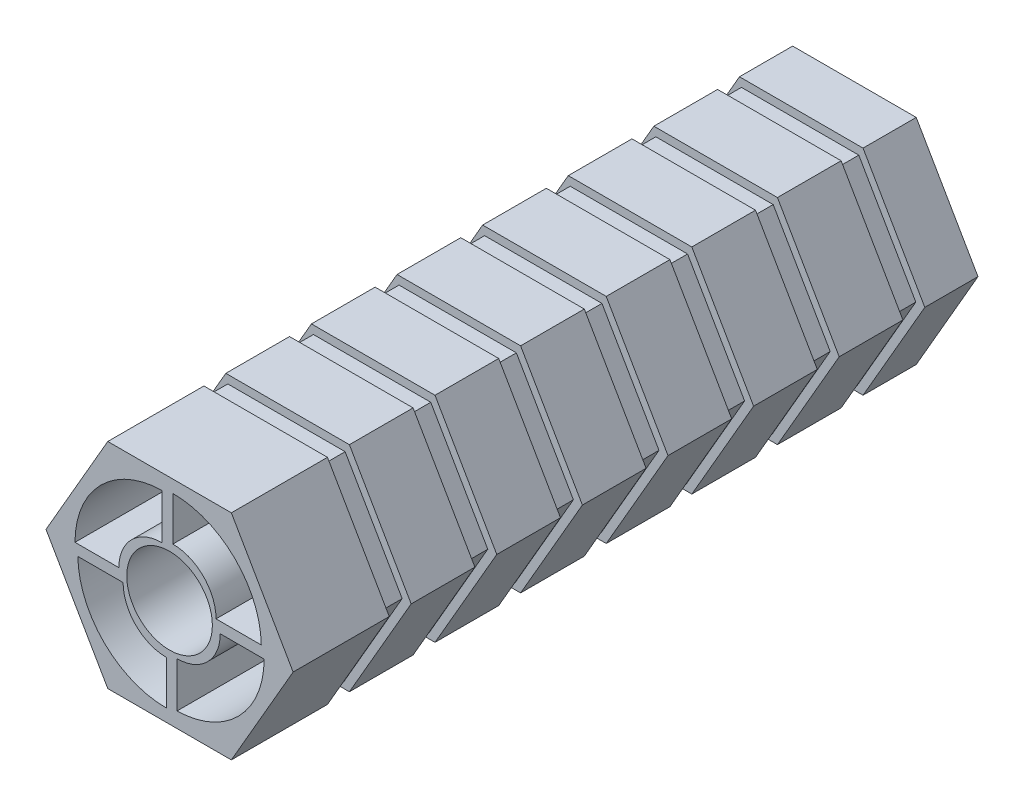
from build123d import *

# Parameters (mm, degrees)
SKETCH1_R           = 5
BOSS_EXTRUDE1_DEPTH = 40
CUT_EXTRUDE1_DEPTH  = 45.32362049
SKETCH6_R           = 5
BOSS_EXTRUDE2_DEPTH = 40
SKETCH7_W           = 2.986363981
SKETCH7_H           = 2.559740555
CUT_EXTRUDE2_DEPTH  = 24
SKETCH9_W           = 2.559740555
SKETCH9_H           = 1.640813603
CUT_EXTRUDE3_DEPTH  = 24
SKETCH10_W          = 3.157013352
SKETCH10_H          = 2.559740555
CUT_EXTRUDE4_DEPTH  = 24
CUT_EXTRUDE5_DEPTH  = 24
SKETCH15_W          = 2.180490195
SKETCH15_H          = 2.559740555
CUT_EXTRUDE6_DEPTH  = 24
SKETCH16_W          = 2.559740555
SKETCH16_H          = 2.986363981
CUT_EXTRUDE7_DEPTH  = 24
SKETCH17_W          = 2.559740555
SKETCH17_H          = 2.753569082
CUT_EXTRUDE8_DEPTH  = 24


with BuildPart() as part:
    # Sketch1 → Boss-Extrude1 (new body)
    with BuildSketch(Plane.XY):
        Polygon((-14.43375673, 0), (-7.216878365, -12.5), (7.216878365, -12.5), (14.43375673, 0), (7.216878365, 12.5), (-7.216878365, 12.5), align=None)
        Circle(SKETCH1_R, mode=Mode.SUBTRACT)
    extrude(amount=BOSS_EXTRUDE1_DEPTH)

    # Sketch2 → Cut-Extrude1 (cut, through all)
    with BuildSketch(Plane.XY.offset(40)):
        with BuildLine():
            Line((-0.876158373, 10.714407614), (-0.876158373, 5.428874285))
            ThreePointArc((-0.876158373, 5.428874285), (-4.443711356, 3.951145455), (-5.921440186, 0.383592471))
            Line((-5.921440186, 0.383592471), (-11.046805838, 0.383592471))
            ThreePointArc((-11.046805838, 0.383592471), (-8.07746326, 7.632175288), (-0.876158373, 10.714407614))
        make_face()
        with BuildLine():
            Line((10.714407614, 0.876158373), (5.428874285, 0.876158373))
            ThreePointArc((5.428874285, 0.876158373), (3.951145455, 4.443711356), (0.383592471, 5.921440186))
            Line((0.383592471, 5.921440186), (0.383592471, 11.046805838))
            ThreePointArc((0.383592471, 11.046805838), (7.632175288, 8.07746326), (10.714407614, 0.876158373))
        make_face()
        with BuildLine():
            Line((0.876158373, -10.714407614), (0.876158373, -5.428874285))
            ThreePointArc((0.876158373, -5.428874285), (4.443711356, -3.951145455), (5.921440186, -0.383592471))
            Line((5.921440186, -0.383592471), (11.046805838, -0.383592471))
            ThreePointArc((11.046805838, -0.383592471), (8.07746326, -7.632175288), (0.876158373, -10.714407614))
        make_face()
        with BuildLine():
            Line((-10.714407614, -0.876158373), (-5.428874285, -0.876158373))
            ThreePointArc((-5.428874285, -0.876158373), (-3.951145455, -4.443711356), (-0.383592471, -5.921440186))
            Line((-0.383592471, -5.921440186), (-0.383592471, -11.046805838))
            ThreePointArc((-0.383592471, -11.046805838), (-7.632175288, -8.07746326), (-10.714407614, -0.876158373))
        make_face()
    extrude(amount=-CUT_EXTRUDE1_DEPTH, mode=Mode.SUBTRACT)

    # Sketch6 → Boss-Extrude2 (add)
    with BuildSketch(Plane(origin=(0, 0, 0), x_dir=(-1, 0, 0), z_dir=(0, 0, -1))):
        Polygon((7.216878365, -12.5), (14.43375673, 0), (7.216878365, 12.5), (-7.216878365, 12.5), (-14.43375673, 0), (-7.216878365, -12.5), align=None)
        Circle(SKETCH6_R, mode=Mode.SUBTRACT)
        with BuildLine():
            ThreePointArc((5.921440186, 0.383592471), (4.443711356, 3.951145455), (0.876158373, 5.428874285))
            Line((0.876158373, 5.428874285), (0.876158373, 10.714407614))
            ThreePointArc((0.876158373, 10.714407614), (8.07746326, 7.632175288), (11.046805838, 0.383592471))
            Line((11.046805838, 0.383592471), (5.921440186, 0.383592471))
        make_face(mode=Mode.SUBTRACT)
        with BuildLine():
            ThreePointArc((-0.383592471, 5.921440186), (-3.951145455, 4.443711356), (-5.428874285, 0.876158373))
            Line((-5.428874285, 0.876158373), (-10.714407614, 0.876158373))
            ThreePointArc((-10.714407614, 0.876158373), (-7.632175288, 8.07746326), (-0.383592471, 11.046805838))
            Line((-0.383592471, 11.046805838), (-0.383592471, 5.921440186))
        make_face(mode=Mode.SUBTRACT)
        with BuildLine():
            ThreePointArc((-5.921440186, -0.383592471), (-4.443711356, -3.951145455), (-0.876158373, -5.428874285))
            Line((-0.876158373, -5.428874285), (-0.876158373, -10.714407614))
            ThreePointArc((-0.876158373, -10.714407614), (-8.07746326, -7.632175288), (-11.046805838, -0.383592471))
            Line((-11.046805838, -0.383592471), (-5.921440186, -0.383592471))
        make_face(mode=Mode.SUBTRACT)
        with BuildLine():
            ThreePointArc((0.383592471, -5.921440186), (3.951145455, -4.443711356), (5.428874285, -0.876158373))
            Line((5.428874285, -0.876158373), (10.714407614, -0.876158373))
            ThreePointArc((10.714407614, -0.876158373), (7.632175288, -8.07746326), (0.383592471, -11.046805838))
            Line((0.383592471, -11.046805838), (0.383592471, -5.921440186))
        make_face(mode=Mode.SUBTRACT)
    extrude(amount=BOSS_EXTRUDE2_DEPTH)

    # Sketch7 → Cut-Extrude2 (cut, along a direction that is not the sketch's normal)
    with BuildSketch(Plane.XZ.offset(12.5)):
        with Locations((-6.996624183, -32.50870505)):
            Rectangle(SKETCH7_W, SKETCH7_H)
    extrude(amount=-CUT_EXTRUDE2_DEPTH, dir=(0.5000000000000001, -0.8660254037844386, 0), mode=Mode.SUBTRACT)

    # Sketch9 → Cut-Extrude3 (cut, along a direction that is not the sketch's normal)
    with BuildSketch(Plane(origin=(-10.825317547, -6.25, 0), x_dir=(0, 0, 1), z_dir=(-0.8660254037844386, -0.5000000000000001, 0))):
        with Locations((-32.50870505, 7.25318965)):
            Rectangle(SKETCH9_W, SKETCH9_H)
        with Locations((-22.50870505, 7.25318965)):
            Rectangle(SKETCH9_W, SKETCH9_H)
        with Locations((-12.50870505, 7.25318965)):
            Rectangle(SKETCH9_W, SKETCH9_H)
        with Locations((-2.50870505, 7.25318965)):
            Rectangle(SKETCH9_W, SKETCH9_H)
        with Locations((7.491294951, 7.25318965)):
            Rectangle(SKETCH9_W, SKETCH9_H)
        with Locations((17.49129495, 7.25318965)):
            Rectangle(SKETCH9_W, SKETCH9_H)
        with Locations((27.491294951, 7.25318965)):
            Rectangle(SKETCH9_W, SKETCH9_H)
    extrude(amount=-CUT_EXTRUDE3_DEPTH, dir=(-0.49999999999999956, -0.8660254037844389, 0), mode=Mode.SUBTRACT)

    # Sketch10 → Cut-Extrude4 (cut, along a direction that is not the sketch's normal)
    with BuildSketch(Plane.XZ.offset(12.5)):
        with Locations((-7.081948869, -32.50870505)):
            Rectangle(SKETCH10_W, SKETCH10_H)
        with Locations((-7.081948869, -22.50870505)):
            Rectangle(SKETCH10_W, SKETCH10_H)
        with Locations((-7.081948869, -12.50870505)):
            Rectangle(SKETCH10_W, SKETCH10_H)
        with Locations((-7.081948869, -2.50870505)):
            Rectangle(SKETCH10_W, SKETCH10_H)
        with Locations((-7.081948869, 7.491294951)):
            Rectangle(SKETCH10_W, SKETCH10_H)
        with Locations((-7.081948869, 17.49129495)):
            Rectangle(SKETCH10_W, SKETCH10_H)
        with Locations((-7.081948869, 27.491294951)):
            Rectangle(SKETCH10_W, SKETCH10_H)
    extrude(amount=-CUT_EXTRUDE4_DEPTH, dir=(0.5000000000000001, -0.8660254037844386, 0), mode=Mode.SUBTRACT)

    # Sketch12 → Cut-Extrude5 (cut, along a direction that is not the sketch's normal)
    with BuildSketch(Plane(origin=(-10.825317547, 6.25, 0), x_dir=(0, 0, 1), z_dir=(-0.8660254037844389, 0.4999999999999996, 0))):
        Polygon((-23.788575327, 9.200199014), (-21.228834772, 9.200199014), (-21.228834772, 7.216878365), (-21.228834772, 6.109654635), (-23.788575327, 6.109654635), (-23.788575327, 7.216878365), align=None)
        Polygon((-13.788575327, 9.200199014), (-11.228834772, 9.200199014), (-11.228834772, 7.216878365), (-11.228834772, 6.109654635), (-13.788575327, 6.109654635), (-13.788575327, 7.216878365), align=None)
        Polygon((-1.228834772, 9.200199014), (-3.788575327, 9.200199014), (-3.788575327, 7.216878365), (-3.788575327, 6.109654635), (-1.228834772, 6.109654635), (-1.228834772, 7.216878365), align=None)
        Polygon((16.211424673, 9.200199014), (18.771165228, 9.200199014), (18.771165228, 7.216878365), (18.771165228, 6.109654635), (16.211424673, 6.109654635), (16.211424673, 7.216878365), align=None)
        Polygon((26.211424673, 9.200199014), (28.771165228, 9.200199014), (28.771165228, 7.216878365), (28.771165228, 6.109654635), (26.211424673, 6.109654635), (26.211424673, 7.216878365), align=None)
        Polygon((-31.228834772, 7.216878365), (-31.228834772, 9.200199014), (-33.788575327, 9.200199014), (-33.788575327, 7.216878365), (-33.788575327, 6.109654635), (-31.228834772, 6.109654635), align=None)
        Polygon((8.771165228, 7.216878365), (8.771165228, 9.200199014), (6.211424673, 9.200199014), (6.211424673, 7.216878365), (6.211424673, 6.109654635), (8.771165228, 6.109654635), align=None)
    extrude(amount=-CUT_EXTRUDE5_DEPTH, dir=(-1, 0, 0), mode=Mode.SUBTRACT)

    # Sketch15 → Cut-Extrude6 (cut, along a direction that is not the sketch's normal)
    with BuildSketch(Plane(origin=(0, 12.5, 0), x_dir=(1, 0, 0), z_dir=(0, 1, 0))):
        with Locations((7.257186714, 32.50870505)):
            Rectangle(SKETCH15_W, SKETCH15_H)
        with Locations((7.257186714, 22.50870505)):
            Rectangle(SKETCH15_W, SKETCH15_H)
        with Locations((7.257186714, 12.50870505)):
            Rectangle(SKETCH15_W, SKETCH15_H)
        with Locations((7.257186714, 2.50870505)):
            Rectangle(SKETCH15_W, SKETCH15_H)
        with Locations((7.257186714, -7.491294951)):
            Rectangle(SKETCH15_W, SKETCH15_H)
        with Locations((7.257186714, -17.49129495)):
            Rectangle(SKETCH15_W, SKETCH15_H)
        with Locations((7.257186714, -27.491294951)):
            Rectangle(SKETCH15_W, SKETCH15_H)
    extrude(amount=-CUT_EXTRUDE6_DEPTH, dir=(-0.5, 0.8660254037844386, 0), mode=Mode.SUBTRACT)

    # Sketch16 → Cut-Extrude7 (cut, along a direction that is not the sketch's normal)
    with BuildSketch(Plane(origin=(10.825317547, 6.25, 0), x_dir=(0, 0, -1), z_dir=(0.8660254037844386, 0.5000000000000003, 0))):
        with Locations((32.50870505, -7.655814825)):
            Rectangle(SKETCH16_W, SKETCH16_H)
        with Locations((22.50870505, -7.655814825)):
            Rectangle(SKETCH16_W, SKETCH16_H)
        with Locations((12.50870505, -7.655814825)):
            Rectangle(SKETCH16_W, SKETCH16_H)
        with Locations((2.50870505, -7.655814825)):
            Rectangle(SKETCH16_W, SKETCH16_H)
        with Locations((-7.491294951, -7.655814825)):
            Rectangle(SKETCH16_W, SKETCH16_H)
        with Locations((-17.49129495, -7.655814825)):
            Rectangle(SKETCH16_W, SKETCH16_H)
        with Locations((-27.491294951, -7.655814825)):
            Rectangle(SKETCH16_W, SKETCH16_H)
    extrude(amount=-CUT_EXTRUDE7_DEPTH, dir=(0.49999999999999983, 0.8660254037844388, 0), mode=Mode.SUBTRACT)

    # Sketch17 → Cut-Extrude8 (cut, along a direction that is not the sketch's normal)
    with BuildSketch(Plane(origin=(10.825317547, -6.25, 0), x_dir=(0, 0, -1), z_dir=(0.8660254037844388, -0.49999999999999983, 0))):
        with Locations((-27.491294951, -7.817452643)):
            Rectangle(SKETCH17_W, SKETCH17_H)
        with Locations((-17.49129495, -7.817452643)):
            Rectangle(SKETCH17_W, SKETCH17_H)
        with Locations((-7.491294951, -7.817452643)):
            Rectangle(SKETCH17_W, SKETCH17_H)
        with Locations((2.50870505, -7.817452643)):
            Rectangle(SKETCH17_W, SKETCH17_H)
        with Locations((12.50870505, -7.817452643)):
            Rectangle(SKETCH17_W, SKETCH17_H)
        with Locations((22.50870505, -7.817452643)):
            Rectangle(SKETCH17_W, SKETCH17_H)
        with Locations((32.50870505, -7.817452643)):
            Rectangle(SKETCH17_W, SKETCH17_H)
    extrude(amount=-CUT_EXTRUDE8_DEPTH, dir=(1, 0, 0), mode=Mode.SUBTRACT)


solid = part.part
